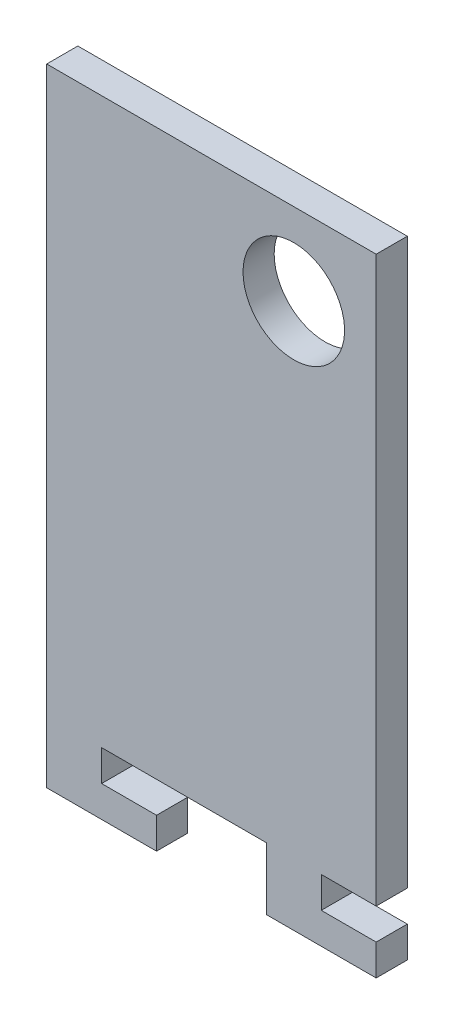
from build123d import *

# Parameters (mm, degrees)
SKETCH1_W           = 50.8
SKETCH1_H           = 96.655493252
BOSS_EXTRUDE1_DEPTH = 4.800000052
SKETCH3_R           = 7.8277466
CUT_EXTRUDE2_DEPTH  = 110.297595473
SKETCH4_W           = 8.466666667
SKETCH4_H           = 4.800000052
SKETCH4_W_2         = 8.466666666
CUT_EXTRUDE4_DEPTH  = 110.297595473
SKETCH5_W           = 16.933333334
SKETCH5_H           = 9.600000104
CUT_EXTRUDE5_DEPTH  = 110.297595473


with BuildPart() as part:
    # Sketch1 → Boss-Extrude1 (new body)
    with BuildSketch(Plane.XY):
        with Locations((25.4, 48.327746626)):
            Rectangle(SKETCH1_W, SKETCH1_H)
    extrude(amount=BOSS_EXTRUDE1_DEPTH)

    # Sketch3 → Cut-Extrude2 (cut, through all)
    with BuildSketch(Plane(origin=(0, 0, 0), x_dir=(-1, 0, 0), z_dir=(0, 0, -1))):
        with Locations((-38.1, 84.0277466)):
            Circle(SKETCH3_R)
    extrude(amount=-CUT_EXTRUDE2_DEPTH, mode=Mode.SUBTRACT)

    # Sketch4 → Cut-Extrude4 (cut, through all)
    with BuildSketch(Plane(origin=(0, 0, 0), x_dir=(-1, 0, 0), z_dir=(0, 0, -1))):
        with Locations((-46.566666667, 7.200000078)):
            Rectangle(SKETCH4_W, SKETCH4_H)
        with Locations((-12.7, 7.200000078)):
            Rectangle(SKETCH4_W_2, SKETCH4_H)
    extrude(amount=-CUT_EXTRUDE4_DEPTH, mode=Mode.SUBTRACT)

    # Sketch5 → Cut-Extrude5 (cut, through all)
    with BuildSketch(Plane(origin=(0, 0, 0), x_dir=(-1, 0, 0), z_dir=(0, 0, -1))):
        with Locations((-25.4, 4.800000052)):
            Rectangle(SKETCH5_W, SKETCH5_H)
    extrude(amount=-CUT_EXTRUDE5_DEPTH, mode=Mode.SUBTRACT)


solid = part.part
